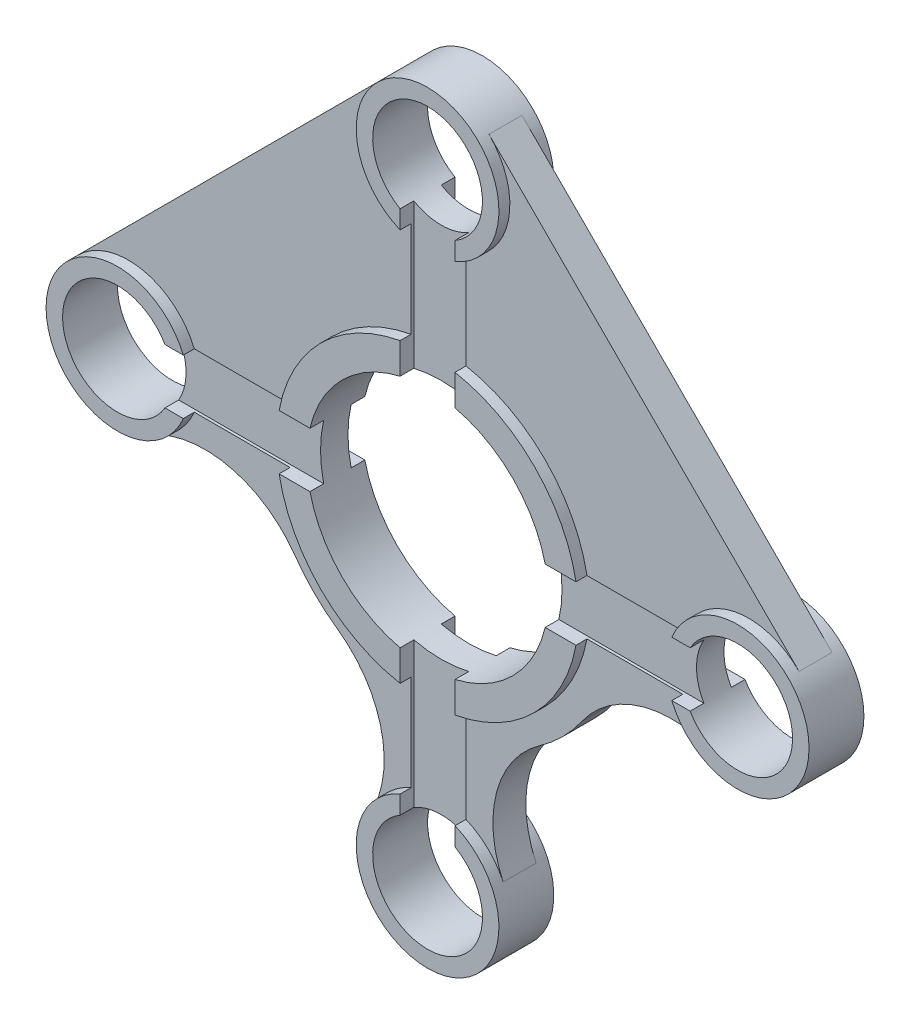
from build123d import *

# Parameters (mm, degrees)
BOSS_EXTRUDE1_DEPTH   = 5
BOSS_EXTRUDE1_2_DEPTH = 5
BOSS_EXTRUDE1_3_DEPTH = 5
BOSS_EXTRUDE1_4_DEPTH = 5
BOSS_EXTRUDE2_DEPTH   = 10
BOSS_EXTRUDE3_DEPTH   = 6
BOSS_EXTRUDE4_DEPTH   = 10


with BuildPart() as part:
    # Sketch1 → Boss-Extrude1 (new, symmetric)
    with BuildSketch(Plane.XY):
        with BuildLine():
            Line((-42.848570571, 10), (-95.679491924, 10))
            ThreePointArc((-95.679491924, 10), (-93, 0), (-95.679491924, -10))
            Line((-95.679491924, -10), (-42.848570571, -10))
            ThreePointArc((-42.848570571, -10), (-44, 0), (-42.848570571, 10))
        make_face()
    extrude(amount=BOSS_EXTRUDE1_DEPTH, both=True)



with BuildPart() as body_2:
    # Sketch1 → Boss-Extrude1 2 (new, symmetric)
    with BuildSketch(Plane.XY):
        with BuildLine():
            Line((-10, 95.679491924), (-10, 42.848570571))
            ThreePointArc((-10, 42.848570571), (0, 44), (10, 42.848570571))
            Line((10, 42.848570571), (10, 95.679491924))
            ThreePointArc((10, 95.679491924), (0, 93), (-10, 95.679491924))
        make_face()
    extrude(amount=BOSS_EXTRUDE1_2_DEPTH, both=True)


with BuildPart() as body_3:
    # Sketch1 → Boss-Extrude1 3 (new, symmetric)
    with BuildSketch(Plane.XY):
        with BuildLine():
            Line((-10, -42.848570571), (-10, -95.679491924))
            ThreePointArc((-10, -95.679491924), (0, -93), (10, -95.679491924))
            Line((10, -95.679491924), (10, -42.848570571))
            ThreePointArc((10, -42.848570571), (0, -44), (-10, -42.848570571))
        make_face()
    extrude(amount=BOSS_EXTRUDE1_3_DEPTH, both=True)


with BuildPart() as body_4:
    # Sketch1 → Boss-Extrude1 4 (new, symmetric)
    with BuildSketch(Plane.XY):
        with BuildLine():
            Line((95.679491924, 10), (42.848570571, 10))
            ThreePointArc((42.848570571, 10), (44, 0), (42.848570571, -10))
            Line((42.848570571, -10), (95.679491924, -10))
            ThreePointArc((95.679491924, -10), (93, 0), (95.679491924, 10))
        make_face()
    extrude(amount=BOSS_EXTRUDE1_4_DEPTH, both=True)


with BuildPart() as part_1:
    add(part.part)

    add(body_2.part)  # Boss-Extrude2 merges body 2

    add(body_3.part)  # Boss-Extrude2 merges body 3

    add(body_4.part)  # Boss-Extrude2 merges body 4
    # Sketch1<3> → Boss-Extrude2 (add, symmetric)
    with BuildSketch(Plane.XY):
        with BuildLine():
            ThreePointArc((-10, 54.083269132), (-38.890872965, 38.890872965), (-54.083269132, 10))
            Line((-54.083269132, 10), (-42.848570571, 10))
            ThreePointArc((-42.848570571, 10), (-31.112698372, 31.112698372), (-10, 42.848570571))
            Line((-10, 42.848570571), (-10, 54.083269132))
        make_face()
        with BuildLine():
            Line((-42.848570571, -10), (-54.083269132, -10))
            ThreePointArc((-54.083269132, -10), (-38.890872965, -38.890872965), (-10, -54.083269132))
            Line((-10, -54.083269132), (-10, -42.848570571))
            ThreePointArc((-10, -42.848570571), (-31.112698372, -31.112698372), (-42.848570571, -10))
        make_face()
        with BuildLine():
            Line((10, 54.083269132), (10, 42.848570571))
            ThreePointArc((10, 42.848570571), (31.112698372, 31.112698372), (42.848570571, 10))
            Line((42.848570571, 10), (54.083269132, 10))
            ThreePointArc((54.083269132, 10), (38.890872965, 38.890872965), (10, 54.083269132))
        make_face()
        with BuildLine():
            ThreePointArc((42.848570571, -10), (31.112698372, -31.112698372), (10, -42.848570571))
            Line((10, -42.848570571), (10, -54.083269132))
            ThreePointArc((10, -54.083269132), (38.890872965, -38.890872965), (54.083269132, -10))
            Line((54.083269132, -10), (42.848570571, -10))
        make_face()
    extrude(amount=BOSS_EXTRUDE2_DEPTH, both=True)

    # Sketch1<4> → Boss-Extrude3 (add, symmetric)
    with BuildSketch(Plane.XY):
        with BuildLine():
            ThreePointArc((-131.384776311, 18.384776311), (-107.954328319, 25.505709112), (-89, 10))
            Line((-89, 10), (-54.083269132, 10))
            ThreePointArc((-54.083269132, 10), (-38.890872965, 38.890872965), (-10, 54.083269132))
            Line((-10, 54.083269132), (-10, 89))
            ThreePointArc((-10, 89), (-25.505709112, 107.954328319), (-18.384776311, 131.384776311))
            Line((-18.384776311, 131.384776311), (-131.384776311, 18.384776311))
        make_face()
        with BuildLine():
            Line((-54.083269132, -10), (-89, -10))
            ThreePointArc((-89, -10), (-94.233874983, -17.995348061), (-102.002815768, -23.559752524))
            ThreePointArc((-102.002815768, -23.559752524), (-74.773631801, -21.15717706), (-52.359428182, -36.803400392))
            ThreePointArc((-52.359428182, -36.803400392), (-45.254833996, -45.254833996), (-36.803400392, -52.359428182))
            ThreePointArc((-36.803400392, -52.359428182), (-21.15717706, -74.773631801), (-23.559752524, -102.002815768))
            ThreePointArc((-23.559752524, -102.002815768), (-17.995348061, -94.233874983), (-10, -89))
            Line((-10, -89), (-10, -54.083269132))
            ThreePointArc((-10, -54.083269132), (-38.890872965, -38.890872965), (-54.083269132, -10))
        make_face()
        with BuildLine():
            Line((131.384776311, 18.384776311), (18.384776311, 131.384776311))
            ThreePointArc((18.384776311, 131.384776311), (25.505709112, 107.954328319), (10, 89))
            Line((10, 89), (10, 54.083269132))
            ThreePointArc((10, 54.083269132), (38.890872965, 38.890872965), (54.083269132, 10))
            Line((54.083269132, 10), (89, 10))
            ThreePointArc((89, 10), (107.954328319, 25.505709112), (131.384776311, 18.384776311))
        make_face()
        with BuildLine():
            ThreePointArc((52.359428182, -36.803400392), (74.773631801, -21.15717706), (102.002815768, -23.559752524))
            ThreePointArc((102.002815768, -23.559752524), (94.233874983, -17.995348061), (89, -10))
            Line((89, -10), (54.083269132, -10))
            ThreePointArc((54.083269132, -10), (38.890872965, -38.890872965), (10, -54.083269132))
            Line((10, -54.083269132), (10, -89))
            ThreePointArc((10, -89), (17.995348061, -94.233874983), (23.559752524, -102.002815768))
            ThreePointArc((23.559752524, -102.002815768), (21.15717706, -74.773631801), (36.803400392, -52.359428182))
            ThreePointArc((36.803400392, -52.359428182), (45.254833996, -45.254833996), (52.359428182, -36.803400392))
        make_face()
    extrude(amount=BOSS_EXTRUDE3_DEPTH, both=True)

    # Sketch1<5> → Boss-Extrude4 (add, symmetric)
    with BuildSketch(Plane.XY):
        with BuildLine():
            ThreePointArc((-95.679491924, -10), (-133, 0), (-95.679491924, 10))
            Line((-95.679491924, 10), (-89, 10))
            ThreePointArc((-89, 10), (-139, 0), (-89, -10))
            Line((-89, -10), (-95.679491924, -10))
        make_face()
        with BuildLine():
            ThreePointArc((10, 89), (0, 139), (-10, 89))
            Line((-10, 89), (-10, 95.679491924))
            ThreePointArc((-10, 95.679491924), (0, 133), (10, 95.679491924))
            Line((10, 95.679491924), (10, 89))
        make_face()
        with BuildLine():
            ThreePointArc((89, -10), (139, 0), (89, 10))
            Line((89, 10), (95.679491924, 10))
            ThreePointArc((95.679491924, 10), (133, 0), (95.679491924, -10))
            Line((95.679491924, -10), (89, -10))
        make_face()
        with BuildLine():
            Line((-10, -95.679491924), (-10, -89))
            ThreePointArc((-10, -89), (0, -139), (10, -89))
            Line((10, -89), (10, -95.679491924))
            ThreePointArc((10, -95.679491924), (0, -133), (-10, -95.679491924))
        make_face()
    extrude(amount=BOSS_EXTRUDE4_DEPTH, both=True)


solid = part_1.part
